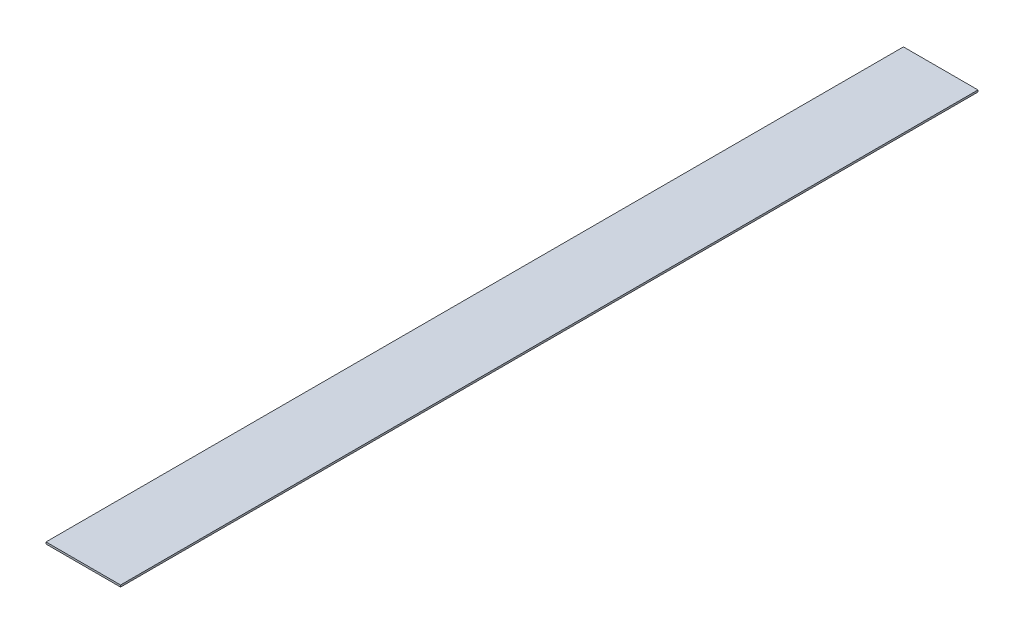
from build123d import *

# Parameters (mm, degrees)
SKETCH_1_W      = 200
SKETCH_1_H      = 5
EXTRUDE_1_DEPTH = 1150


with BuildPart() as part:
    # Эскиз1 → Бобышка-Вытянуть1 (new, symmetric)
    with BuildSketch(Plane.XY):
        Rectangle(SKETCH_1_W, SKETCH_1_H)
    extrude(amount=EXTRUDE_1_DEPTH, both=True)


solid = part.part
